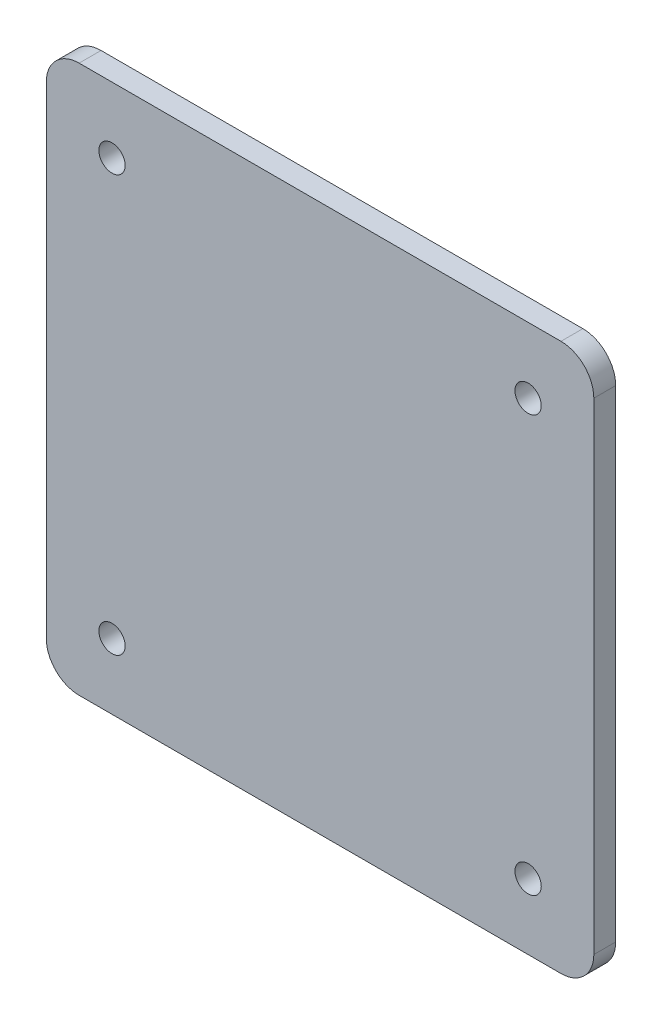
from build123d import *

# Parameters (mm, degrees)
SKETCH1_R           = 6
BOSS_EXTRUDE1_DEPTH = 10


with BuildPart() as part:
    # Sketch1 → Boss-Extrude1 (new body)
    with BuildSketch(Plane.XY):
        with BuildLine():
            Line((-110, 125), (110, 125))
            ThreePointArc((110, 125), (120.606601718, 120.606601718), (125, 110))
            Line((125, 110), (125, -110))
            ThreePointArc((125, -110), (120.606601718, -120.606601718), (110, -125))
            Line((110, -125), (-110, -125))
            ThreePointArc((-110, -125), (-120.606601718, -120.606601718), (-125, -110))
            Line((-125, -110), (-125, 110))
            ThreePointArc((-125, 110), (-120.606601718, 120.606601718), (-110, 125))
        make_face()
        with Locations((-95, 95)):
            Circle(SKETCH1_R, mode=Mode.SUBTRACT)
        with Locations((-95, -95)):
            Circle(SKETCH1_R, mode=Mode.SUBTRACT)
        with Locations((95, -95)):
            Circle(SKETCH1_R, mode=Mode.SUBTRACT)
        with Locations((95, 95)):
            Circle(SKETCH1_R, mode=Mode.SUBTRACT)
    extrude(amount=BOSS_EXTRUDE1_DEPTH)


solid = part.part
